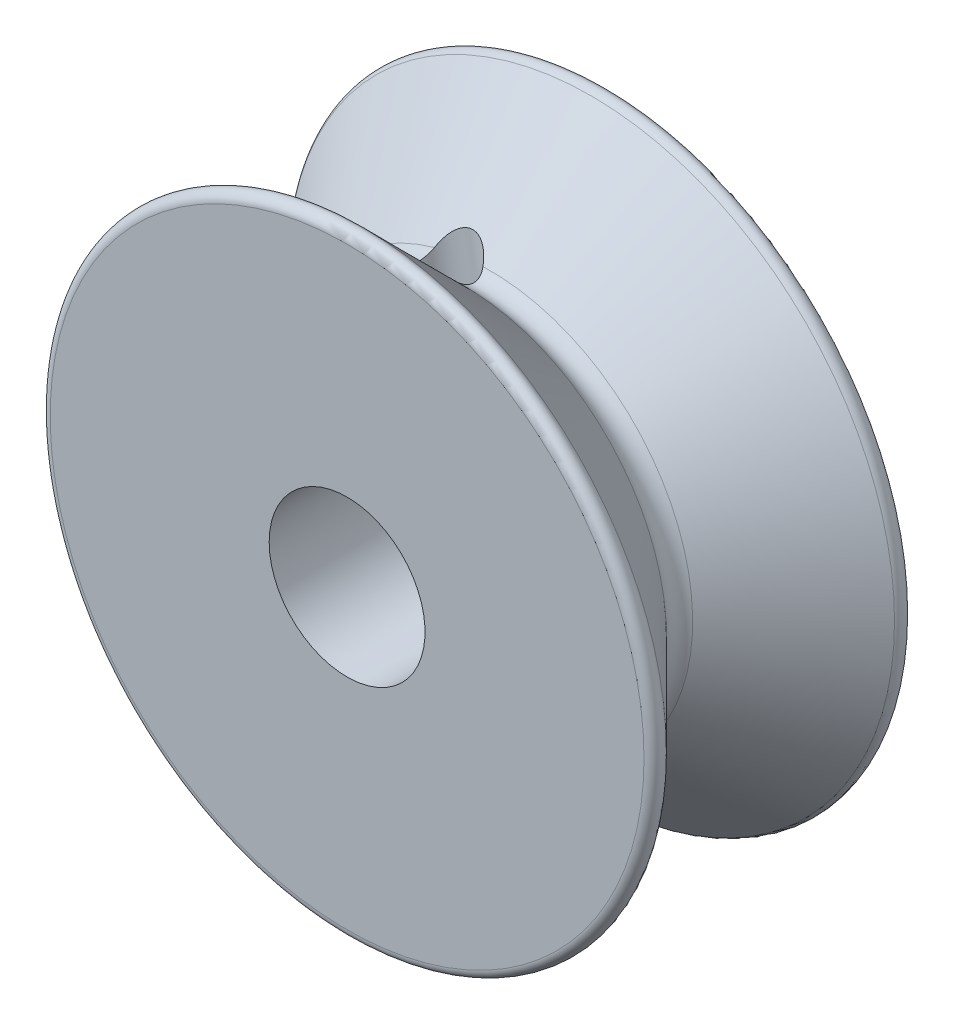
from build123d import *

# Parameters (mm, degrees)
SKETCH2_R               = 4
BOSS_EXTRUDE1_DEPTH     = 2.9
SKETCH3_R               = 3
SKETCH3_R_2             = 1.2
BOSS_EXTRUDE2_DEPTH     = 2
BOSS_EXTRUDE3_START     = 3.4
SKETCH5_R               = 4
SKETCH5_R_2             = 2.1
BOSS_EXTRUDE3_DEPTH     = 3.4
CUT_EXTRUDE1_DEPTH      = 14.494690563
CUT_EXTRUDE1_DEPTH_BACK = 14.494690563
SKETCH7_R               = 0.75


with BuildPart() as part:
    # Sketch2 → Boss-Extrude1 (new body)
    with BuildSketch(Plane.XY):
        with Locations((0, 5.45)):
            Circle(SKETCH2_R)
        Polygon((-0.367620993, 7.7710676), (0.006506124, 8.0210676), (0.367620993, 7.7710676), (0.800691274, 7.893220092), (1.066877674, 7.543865332), (1.516499183, 7.526213179), (1.661700936, 7.111700936), (2.083861586, 6.955972053), (2.093865332, 6.516877674), (2.447241098, 6.238315891), (2.3210676, 5.817620993), (2.5710676, 5.443493876), (2.3210676, 5.082379007), (2.443220092, 4.649308726), (2.093865332, 4.383122326), (2.076213179, 3.933500817), (1.661700936, 3.788299064), (1.505972053, 3.366138414), (1.066877674, 3.356134668), (0.788315891, 3.002758902), (0.367620993, 3.1289324), (-0.006506124, 2.8789324), (-0.367620993, 3.1289324), (-0.800691274, 3.006779908), (-1.066877674, 3.356134668), (-1.516499183, 3.373786821), (-1.661700936, 3.788299064), (-2.083861586, 3.944027947), (-2.093865332, 4.383122326), (-2.447241098, 4.661684109), (-2.3210676, 5.082379007), (-2.5710676, 5.456506124), (-2.3210676, 5.817620993), (-2.443220092, 6.250691274), (-2.093865332, 6.516877674), (-2.076213179, 6.966499183), (-1.661700936, 7.111700936), (-1.505972053, 7.533861586), (-1.066877674, 7.543865332), (-0.788315891, 7.897241098), align=None, mode=Mode.SUBTRACT)
    extrude(amount=-BOSS_EXTRUDE1_DEPTH)

    # Sketch3 → Boss-Extrude2 (add)
    with BuildSketch(Plane.XY):
        with Locations((0, 5.45)):
            Circle(SKETCH3_R)
        with Locations((0, 5.45)):
            Circle(SKETCH3_R_2, mode=Mode.SUBTRACT)
    extrude(amount=BOSS_EXTRUDE2_DEPTH)



with BuildPart() as body_2:
    # Sketch4 → Revolve1 (revolve)
    with BuildSketch(Plane(origin=(-0.84207131, 5.316629007, 0), x_dir=(0.9876883405951381, 0.1564344650402286, 0), z_dir=(-0.1564344650402286, 0.9876883405951381, 0)), mode=Mode.PRIVATE) as revolve1_sk:
        with BuildLine():
            Line((-3.147432166, 1.6), (-7.147432166, 1.6))
            ThreePointArc((-7.147432166, 1.6), (-7.378402049, 1.445670858), (-7.324208861, 1.173223305))
            Line((-7.324208861, 1.173223305), (-4.604538947, -1.546446609))
            ThreePointArc((-4.604538947, -1.546446609), (-4.458092337, -1.9), (-4.604538947, -2.253553391))
            Line((-4.604538947, -2.253553391), (-7.324208861, -4.973223305))
            ThreePointArc((-7.324208861, -4.973223305), (-7.378402049, -5.245670858), (-7.147432166, -5.4))
            Line((-7.147432166, -5.4), (-3.147432166, -5.4))
            Line((-3.147432166, -5.4), (-3.147432166, 1.6))
        make_face()
    revolve(revolve1_sk.sketch.rotate(Axis((0, 5.45, 2), (0, 0, -1)), 189), axis=Axis((0, 5.45, 2), (0, 0, -1)))


with BuildPart() as part_1:
    add(part.part)

    add(body_2.part)  # Boss-Extrude3 merges body 2
    # Sketch5 → Boss-Extrude3 (add)
    with BuildSketch(Plane.XY.offset(2).offset(BOSS_EXTRUDE3_START)):
        with Locations((0, 5.45)):
            Circle(SKETCH5_R)
        with Locations(Location((0, 5.45, 0), (0, 0, 180))):
            Circle(SKETCH5_R_2, mode=Mode.SUBTRACT)
    extrude(amount=-BOSS_EXTRUDE3_DEPTH)

    # Sketch7 → Cut-Extrude1 (cut, two sides: drawn at the far end of the back side and taken through both)
    with BuildSketch(Plane(origin=(-0.84207131, 5.316629007, 0), x_dir=(0.9876883405951381, 0.1564344650402286, 0), z_dir=(-0.1564344650402286, 0.9876883405951381, 0)).offset(-CUT_EXTRUDE1_DEPTH_BACK)):
        with Locations(Location((0.852567834, -1.9, 0), (0, 0, 187.662255661))):
            Circle(SKETCH7_R)
    extrude(amount=CUT_EXTRUDE1_DEPTH + CUT_EXTRUDE1_DEPTH_BACK, mode=Mode.SUBTRACT)


solid = part_1.part
